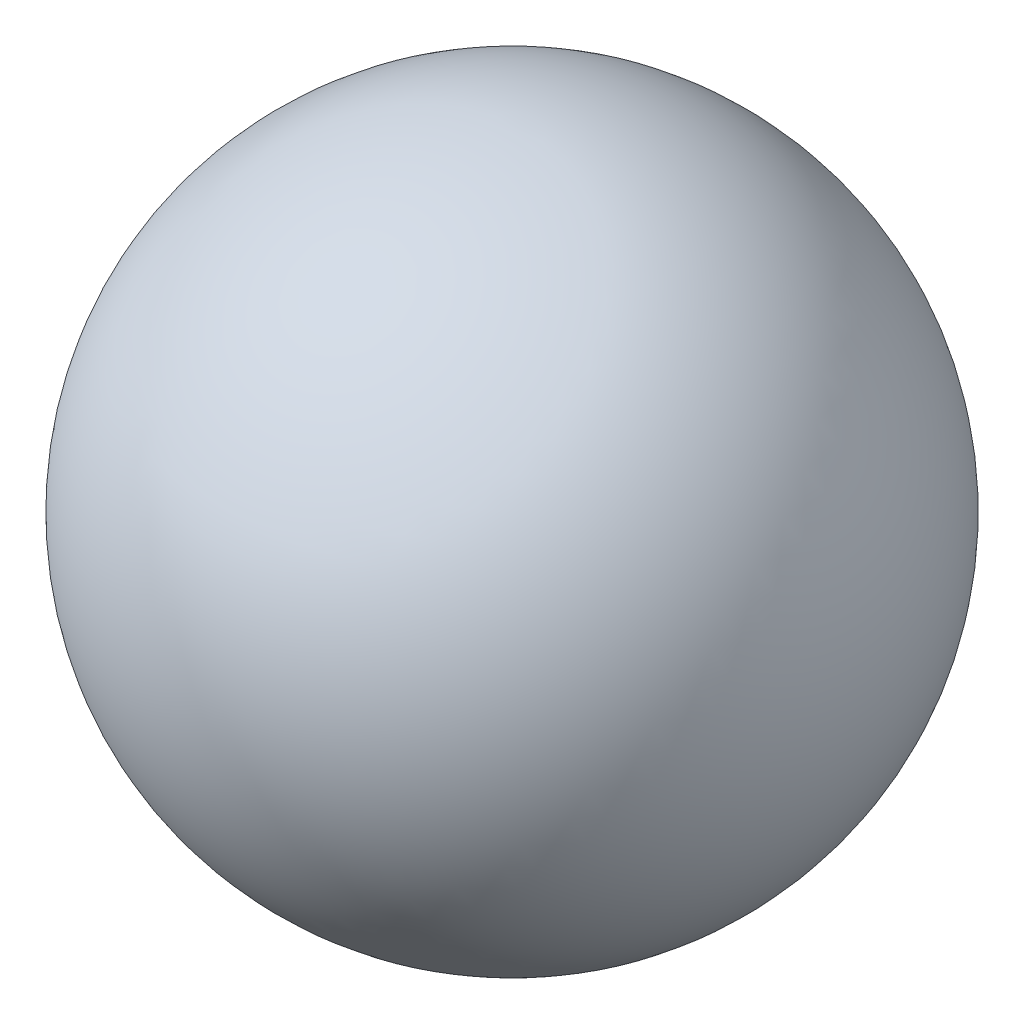
from build123d import *


with BuildPart() as part:
    # Sketch1 → Revolve1 (revolve)
    with BuildSketch(Plane.XY):
        with BuildLine():
            Line((0, 50.8), (0, -50.8))
            ThreePointArc((0, -50.8), (50.8, 0), (0, 50.8))
        make_face()
    revolve(axis=Axis((0, 50.8, 0), (0, -1, 0)))


solid = part.part
